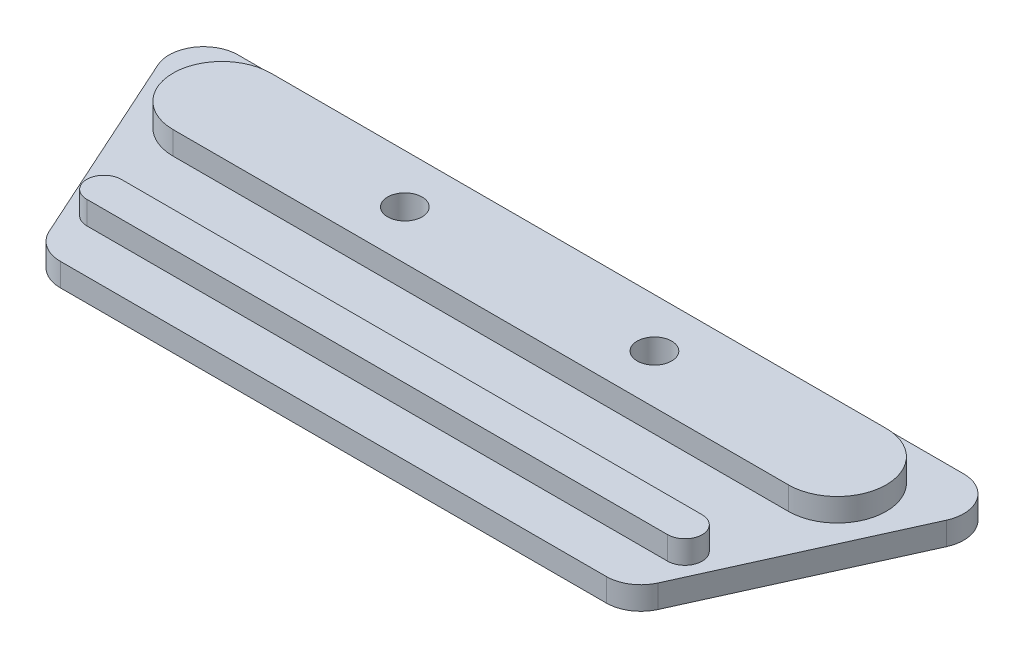
from build123d import *

# Parameters (mm, degrees)
SKETCH_1_R      = 1.5
EXTRUDE_1_DEPTH = 2
SKETCH_1_3_R    = 1.5
EXTRUDE_2_DEPTH = 4


with BuildPart() as part:
    # 草图1 → 凸台-拉伸1 (new body)
    with BuildSketch(Plane(origin=(0, 0, 0), x_dir=(1, 0, 0), z_dir=(0, 1, 0))):
        with BuildLine():
            Line((-23.735839254, -5.318814311), (23.735839254, -5.318814311))
            ThreePointArc((23.735839254, -5.318814311), (25.362389906, -4.839594543), (26.469290407, -3.555036294))
            Line((26.469290407, -3.555036294), (34.277924852, 13.710892585))
            ThreePointArc((34.277924852, 13.710892585), (34.06525393, 16.57366522), (31.544473698, 17.947114568))
            Line((31.544473698, 17.947114568), (-31.544473698, 17.947114568))
            ThreePointArc((-31.544473698, 17.947114568), (-34.06525393, 16.57366522), (-34.277924852, 13.710892585))
            Line((-34.277924852, 13.710892585), (-26.469290407, -3.555036294))
            ThreePointArc((-26.469290407, -3.555036294), (-25.362389906, -4.839594543), (-23.735839254, -5.318814311))
        make_face()
        with Locations((-10.85, 11.75)):
            Circle(SKETCH_1_R, mode=Mode.SUBTRACT)
        with Locations((10.85, 11.75)):
            Circle(SKETCH_1_R, mode=Mode.SUBTRACT)
    extrude(amount=EXTRUDE_1_DEPTH)

    # 草图1<3> → 凸台-拉伸2 (add)
    # profile 1 of 2: a face of its own
    with BuildSketch(Plane(origin=(0, 0, 0), x_dir=(1, 0, 0), z_dir=(0, 1, 0))):
        with BuildLine():
            Line((26.75, 16), (-26.75, 16))
            ThreePointArc((-26.75, 16), (-31, 11.75), (-26.75, 7.5))
            Line((-26.75, 7.5), (26.75, 7.5))
            ThreePointArc((26.75, 7.5), (31, 11.75), (26.75, 16))
        make_face()
        with Locations((-10.85, 11.75)):
            Circle(SKETCH_1_3_R, mode=Mode.SUBTRACT)
        with Locations((10.85, 11.75)):
            Circle(SKETCH_1_3_R, mode=Mode.SUBTRACT)
    # profile 2 of 2: a face of its own
    with BuildSketch(Plane(origin=(0, 0, 0), x_dir=(1, 0, 0), z_dir=(0, 1, 0))):
        with BuildLine():
            ThreePointArc((-25.25, 1.5), (-26.75, 0), (-25.25, -1.5))
            Line((-25.25, -1.5), (25.25, -1.5))
            ThreePointArc((25.25, -1.5), (26.75, 0), (25.25, 1.5))
            Line((25.25, 1.5), (-25.25, 1.5))
        make_face()
    extrude(amount=EXTRUDE_2_DEPTH)


solid = part.part
